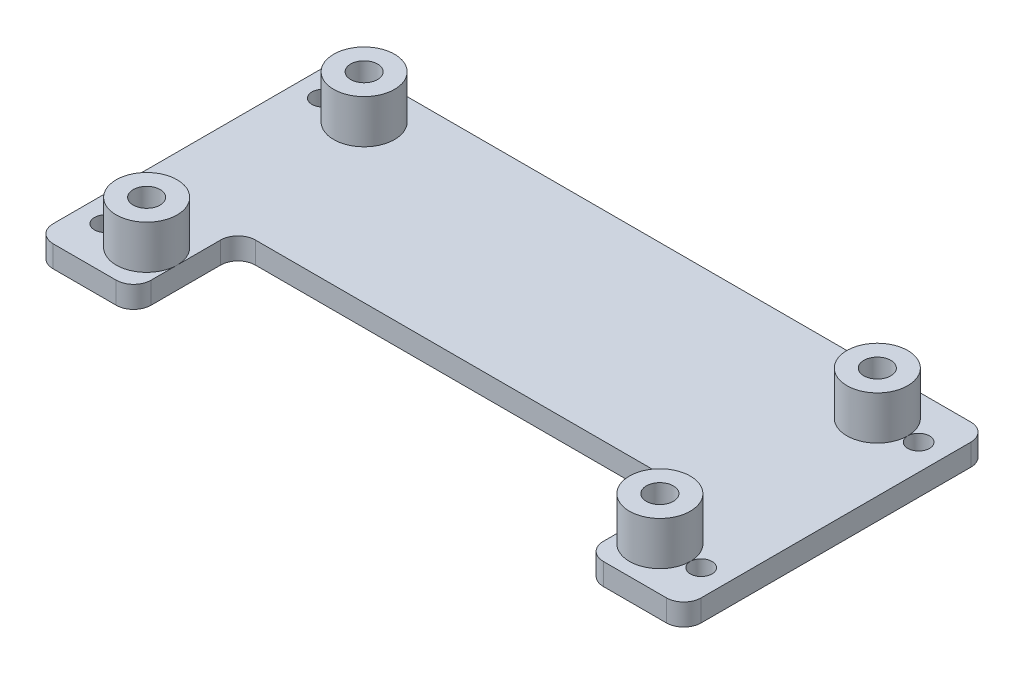
from build123d import *

# Parameters (mm, degrees)
SKETCH1_W           = 94.615
SKETCH1_H           = 44.45
BOSS_EXTRUDE1_DEPTH = 3.175
SKETCH2_R           = 4.445
SKETCH2_R_2         = 1.9685
BOSS_EXTRUDE2_DEPTH = 6.35
SKETCH4_R           = 1.5875
CUT_EXTRUDE1_DEPTH  = 6.35
FILLET1_R           = 2.54
SKETCH6_W           = 66.04
SKETCH6_H           = 15.24
CUT_EXTRUDE2_DEPTH  = 5.08
FILLET2_R           = 2.54


with BuildPart() as part:
    # Sketch1 → Boss-Extrude1 (new body)
    with BuildSketch(Plane(origin=(0, 0, 0), x_dir=(1, 0, 0), z_dir=(0, 1, 0))):
        with Locations((47.3075, 22.225)):
            Rectangle(SKETCH1_W, SKETCH1_H)
    extrude(amount=BOSS_EXTRUDE1_DEPTH)

    # Sketch2 → Boss-Extrude2 (add)
    # profile 1 of 4: a face of its own
    with BuildSketch(Plane(origin=(0, 3.175, 0), x_dir=(1, 0, 0), z_dir=(0, 1, 0))):
        with Locations(Location((9.8425, 6.35, 0), (0, 0, 270))):
            Circle(SKETCH2_R)
        with Locations(Location((9.8425, 6.35, 0), (0, 0, 270))):
            Circle(SKETCH2_R_2, mode=Mode.SUBTRACT)
    # profile 2 of 4: a face of its own
    with BuildSketch(Plane(origin=(0, 3.175, 0), x_dir=(1, 0, 0), z_dir=(0, 1, 0))):
        with Locations(Location((9.8425, 38.1, 0), (0, 0, 270))):
            Circle(SKETCH2_R)
        with Locations(Location((9.8425, 38.1, 0), (0, 0, 270))):
            Circle(SKETCH2_R_2, mode=Mode.SUBTRACT)
    # profile 3 of 4: a face of its own
    with BuildSketch(Plane(origin=(0, 3.175, 0), x_dir=(1, 0, 0), z_dir=(0, 1, 0))):
        with Locations(Location((84.7725, 38.1, 0), (0, 0, 270))):
            Circle(SKETCH2_R)
        with Locations(Location((84.7725, 38.1, 0), (0, 0, 270))):
            Circle(SKETCH2_R_2, mode=Mode.SUBTRACT)
    # profile 4 of 4: a face of its own
    with BuildSketch(Plane(origin=(0, 3.175, 0), x_dir=(1, 0, 0), z_dir=(0, 1, 0))):
        with Locations(Location((84.7725, 6.35, 0), (0, 0, 270))):
            Circle(SKETCH2_R)
        with Locations(Location((84.7725, 6.35, 0), (0, 0, 270))):
            Circle(SKETCH2_R_2, mode=Mode.SUBTRACT)
    extrude(amount=BOSS_EXTRUDE2_DEPTH)

    # Sketch4 → Cut-Extrude1 (cut)
    with BuildSketch(Plane(origin=(0, 3.175, 0), x_dir=(1, 0, 0), z_dir=(0, 1, 0))):
        with Locations(Location((3.81, 38.1, 0), (0, 0, 270))):
            Circle(SKETCH4_R)
        with Locations(Location((3.81, 6.35, 0), (0, 0, 270))):
            Circle(SKETCH4_R)
        with Locations(Location((90.805, 38.1, 0), (0, 0, 270))):
            Circle(SKETCH4_R)
        with Locations(Location((90.805, 6.35, 0), (0, 0, 270))):
            Circle(SKETCH4_R)
    extrude(amount=-CUT_EXTRUDE1_DEPTH, mode=Mode.SUBTRACT)

    # Fillet1
    fillet1_edges = [part.edges().sort_by_distance(p)[0] for p in [
        (0, 1.5875, -44.45),
        (0, 1.5875, 0),
        (94.615, 1.5875, 0),
        (94.615, 1.5875, -44.45),
    ]]
    fillet(fillet1_edges, radius=FILLET1_R)

    # Sketch6 → Cut-Extrude2 (cut)
    with BuildSketch(Plane(origin=(0, 3.175, 0), x_dir=(1, 0, 0), z_dir=(0, 1, 0))):
        with Locations((47.3075, 7.62)):
            Rectangle(SKETCH6_W, SKETCH6_H)
    extrude(amount=-CUT_EXTRUDE2_DEPTH, mode=Mode.SUBTRACT)

    # Fillet2
    fillet2_edges = [part.edges().sort_by_distance(p)[0] for p in [
        (14.2875, 1.5875, 0),
        (14.2875, 1.5875, -15.24),
        (80.3275, 1.5875, -15.24),
        (80.3275, 1.5875, 0),
    ]]
    fillet(fillet2_edges, radius=FILLET2_R)


solid = part.part
